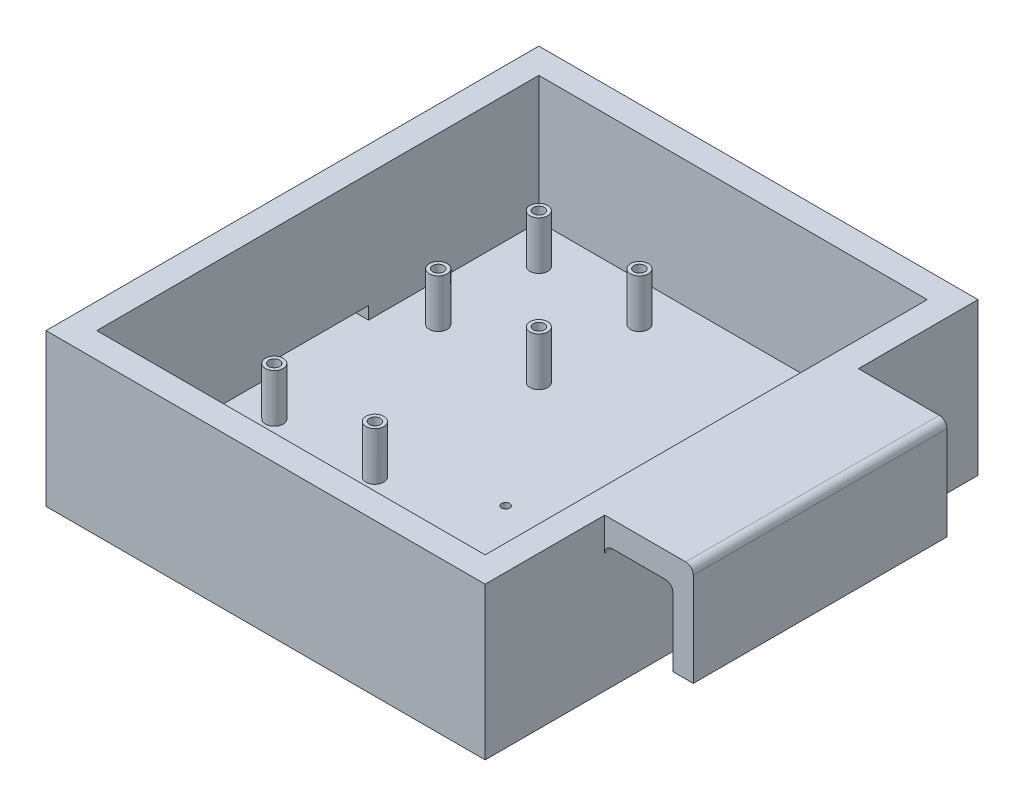
from build123d import *

# Parameters (mm, degrees)
CROQUIS1_W              = 173.1
CROQUIS1_H              = 194.252873564
SALIENTE_EXTRUIR1_DEPTH = 60
VACIADO1_T              = -10
CROQUIS2_R              = 3.5
CROQUIS2_R_2            = 2.165
SALIENTE_EXTRUIR2_DEPTH = 19
CROQUIS3_R              = 1.59
CROQUIS3_R_2            = 1.5875
CORTAR_EXTRUIR1_DEPTH   = 19
CROQUIS5_W              = 40
CROQUIS5_H              = 5
CORTAR_EXTRUIR2_DEPTH   = 19
CROQUIS6_W              = 26.9
CROQUIS6_H              = 100
SALIENTE_EXTRUIR3_DEPTH = 10
CROQUIS7_W              = 8
CROQUIS7_H              = 100
SALIENTE_EXTRUIR4_DEPTH = 40
REDONDEO1_R             = 3
REDONDEO2_R             = 3


with BuildPart() as part:
    # Croquis1 → Saliente-Extruir1 (new body)
    with BuildSketch(Plane(origin=(0, 0, 0), x_dir=(1, 0, 0), z_dir=(0, 1, 0))):
        with Locations((-113.45, 0)):
            Rectangle(CROQUIS1_W, CROQUIS1_H)
    extrude(amount=SALIENTE_EXTRUIR1_DEPTH)

    # Vaciado1
    vaciado1_openings = [part.faces().sort_by_distance(p)[0] for p in [
        (-113.45, 60, 0),
    ]]
    offset(amount=VACIADO1_T, openings=vaciado1_openings, kind=Kind.INTERSECTION)

    # Croquis2 → Saliente-Extruir2 (add)
    # profile 1 of 4: a face of its own
    with BuildSketch(Plane(origin=(0, 10, 0), x_dir=(1, 0, 0), z_dir=(0, 1, 0))):
        with Locations(Location((-135.185, 32.311436782, 0), (0, 0, 270))):
            Circle(CROQUIS2_R)
        with Locations(Location((-135.185, 32.311436782, 0), (0, 0, 270))):
            Circle(CROQUIS2_R_2, mode=Mode.SUBTRACT)
    # profile 2 of 4: a face of its own
    with BuildSketch(Plane(origin=(0, 10, 0), x_dir=(1, 0, 0), z_dir=(0, 1, 0))):
        with Locations(Location((-174.835, 32.311436782, 0), (0, 0, 270))):
            Circle(CROQUIS2_R)
        with Locations(Location((-174.835, 32.311436782, 0), (0, 0, 270))):
            Circle(CROQUIS2_R_2, mode=Mode.SUBTRACT)
    # profile 3 of 4: a face of its own
    with BuildSketch(Plane(origin=(0, 10, 0), x_dir=(1, 0, 0), z_dir=(0, 1, 0))):
        with Locations(Location((-174.835, 71.961436782, 0), (0, 0, 270))):
            Circle(CROQUIS2_R)
        with Locations(Location((-174.835, 71.961436782, 0), (0, 0, 270))):
            Circle(CROQUIS2_R_2, mode=Mode.SUBTRACT)
    # profile 4 of 4: a face of its own
    with BuildSketch(Plane(origin=(0, 10, 0), x_dir=(1, 0, 0), z_dir=(0, 1, 0))):
        with Locations(Location((-135.185, 71.961436782, 0), (0, 0, 270))):
            Circle(CROQUIS2_R)
        with Locations(Location((-135.185, 71.961436782, 0), (0, 0, 270))):
            Circle(CROQUIS2_R_2, mode=Mode.SUBTRACT)
    saliente_extruir2 = extrude(amount=SALIENTE_EXTRUIR2_DEPTH)

    # Simetría1: Saliente-Extruir2 across plane
    add(saliente_extruir2.mirror(Plane.XY))

    # Croquis3 → Cortar-Extruir1 (cut)
    # profile 1 of 5: a face of its own
    with BuildSketch(Plane(origin=(0, 10, 0), x_dir=(1, 0, 0), z_dir=(0, 1, 0))):
        with Locations(Location((-99.618504427, -16.326436782, 0), (0, 0, 270))):
            Circle(CROQUIS3_R)
    # profile 2 of 5: a face of its own
    with BuildSketch(Plane(origin=(0, 10, 0), x_dir=(1, 0, 0), z_dir=(0, 1, 0))):
        with Locations(Location((-51.358504427, -16.326436782, 0), (0, 0, 270))):
            Circle(CROQUIS3_R)
    # profile 3 of 5: a face of its own
    with BuildSketch(Plane(origin=(0, 10, 0), x_dir=(1, 0, 0), z_dir=(0, 1, 0))):
        with Locations(Location((-94.538504427, -67.126436782, 0), (0, 0, 270))):
            Circle(CROQUIS3_R)
    # profile 4 of 5: a face of its own
    with BuildSketch(Plane(origin=(0, 10, 0), x_dir=(1, 0, 0), z_dir=(0, 1, 0))):
        with Locations(Location((-66.598504427, -67.126436782, 0), (0, 0, 270))):
            Circle(CROQUIS3_R)
    # profile 5 of 5: a face of its own
    with BuildSketch(Plane(origin=(0, 10, 0), x_dir=(1, 0, 0), z_dir=(0, 1, 0))):
        Polygon((12.20327424, 3.574424869), (9.66327424, 1.034424869), (-3.29072576, 1.034424869), (-3.29072576, -65.005575131), (50.04927424, -65.005575131), (50.04927424, 1.034424869), (47.50927424, 1.034424869), (44.96927424, 3.574424869), align=None)
        with Locations((14.48927424, 1.034424869)):
            Circle(CROQUIS3_R_2, mode=Mode.SUBTRACT)
        with Locations((42.42927424, 1.034424869)):
            Circle(CROQUIS3_R_2, mode=Mode.SUBTRACT)
        with Locations((47.50927424, -51.035575131)):
            Circle(CROQUIS3_R_2, mode=Mode.SUBTRACT)
        with Locations((-0.75072576, -49.765575131)):
            Circle(CROQUIS3_R_2, mode=Mode.SUBTRACT)
    extrude(amount=-CORTAR_EXTRUIR1_DEPTH, mode=Mode.SUBTRACT)

    # Croquis5 → Cortar-Extruir2 (cut)
    with BuildSketch(Plane(origin=(-190, 0, 0), x_dir=(0, 0, -1), z_dir=(1, 0, 0))):
        with Locations((0, 12.5)):
            Rectangle(CROQUIS5_W, CROQUIS5_H)
    extrude(amount=-CORTAR_EXTRUIR2_DEPTH, mode=Mode.SUBTRACT)

    # Croquis6 → Saliente-Extruir3 (add)
    with BuildSketch(Plane(origin=(0, 60, 0), x_dir=(1, 0, 0), z_dir=(0, 1, 0))):
        with Locations((-13.45, 0)):
            Rectangle(CROQUIS6_W, CROQUIS6_H)
    extrude(amount=-SALIENTE_EXTRUIR3_DEPTH)

    # Croquis7 → Saliente-Extruir4 (add)
    with BuildSketch(Plane(origin=(0, 60, 0), x_dir=(1, 0, 0), z_dir=(0, 1, 0))):
        with Locations((4, 0)):
            Rectangle(CROQUIS7_W, CROQUIS7_H)
    extrude(amount=-SALIENTE_EXTRUIR4_DEPTH)

    # Redondeo1
    redondeo1_edges = [part.edges().sort_by_distance(p)[0] for p in [
        (-26.9, 50, 0),
        (0, 50, 0),
    ]]
    fillet(redondeo1_edges, radius=REDONDEO1_R)

    # Redondeo2
    redondeo2_edges = [part.edges().sort_by_distance(p)[0] for p in [
        (8, 60, 0),
    ]]
    fillet(redondeo2_edges, radius=REDONDEO2_R)


solid = part.part
